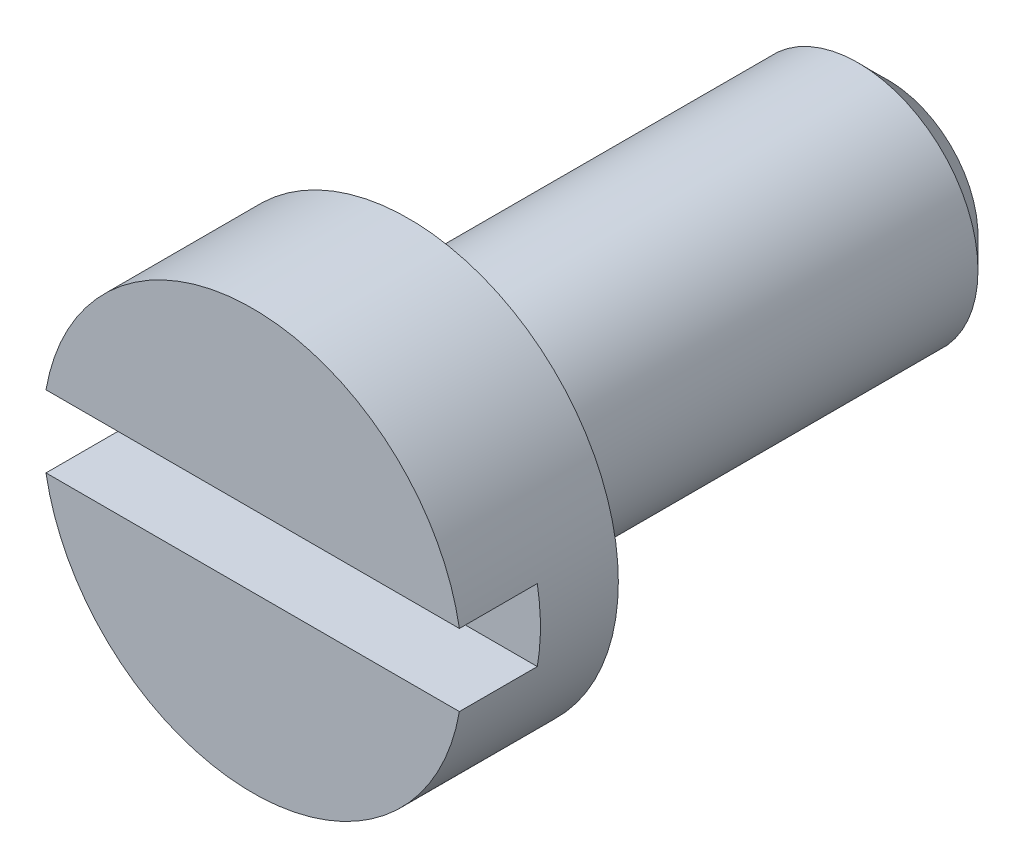
from build123d import *

# Parameters (mm, degrees)
SKETCH_1_R               = 3.5
EXTRUDE_1_DEPTH          = 2.6
SKETCH_2_R               = 2
EXTRUDE_2_DEPTH          = 8
CHAMFER_1_SIZE           = 0.5
CUT_EXTRUDE_1_DEPTH      = 10.407443861
CUT_EXTRUDE_1_DEPTH_BACK = 10.407443861
SKETCH_3_W               = 1.3
SKETCH_3_H               = 1.2


with BuildPart() as part:
    # Эскиз1 → Бобышка-Вытянуть1 (new body)
    with BuildSketch(Plane.XY):
        Circle(SKETCH_1_R)
    extrude(amount=EXTRUDE_1_DEPTH)

    # Эскиз2 → Бобышка-Вытянуть2 (add)
    with BuildSketch(Plane(origin=(0, 0, 0), x_dir=(-1, 0, 0), z_dir=(0, 0, -1))):
        with Locations(Location((0, 0, 0), (0, 0, 180))):
            Circle(SKETCH_2_R)
    extrude(amount=EXTRUDE_2_DEPTH)

    # Фаска1
    chamfer_1_edges = [part.edges().sort_by_distance(p)[0] for p in [
        (-2, 0, -8),
    ]]
    chamfer(chamfer_1_edges, length=CHAMFER_1_SIZE)

    # Эскиз3 → Вырез-Вытянуть1 (cut, two sides: drawn at the far end of the back side and taken through both)
    with BuildSketch(Plane(origin=(0, 0, 0), x_dir=(0, 0, -1), z_dir=(1, 0, 0)).offset(-CUT_EXTRUDE_1_DEPTH_BACK)):
        with Locations((-1.95, 0)):
            Rectangle(SKETCH_3_W, SKETCH_3_H)
    extrude(amount=CUT_EXTRUDE_1_DEPTH + CUT_EXTRUDE_1_DEPTH_BACK, mode=Mode.SUBTRACT)


solid = part.part
